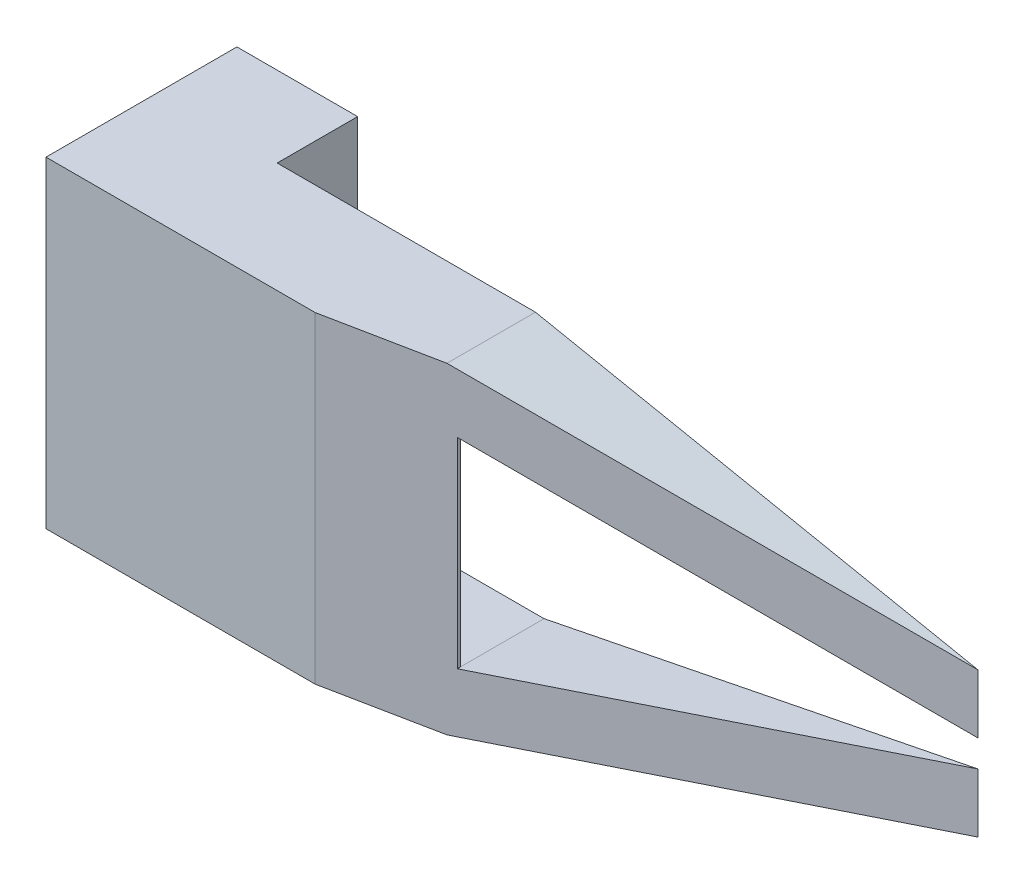
from build123d import *

# Parameters (mm, degrees)
BOSS_EXTRUDE1_DEPTH = 12
CUT_EXTRUDE1_DEPTH  = 8
CUT_EXTRUDE2_DEPTH  = 8
SKETCH6_W           = 4.5
SKETCH6_H           = 12
BOSS_EXTRUDE2_DEPTH = 3
BOSS_EXTRUDE3_DEPTH = 12
CUT_EXTRUDE3_START  = -14.451452
SKETCH8_W           = 3.67843884
SKETCH8_H           = 7.47183246
CUT_EXTRUDE3_DEPTH  = 14.451452


with BuildPart() as part:
    # Sketch1 → Boss-Extrude1 (new body)
    with BuildSketch(Plane(origin=(0, 0, 0), x_dir=(1, 0, 0), z_dir=(0, 1, 0))):
        Polygon((20.786387433, 2.157277486), (8.786387433, 2.157277486), (8.786387433, 5.883484052), (39.417420271, 5.883484052), align=None)
    extrude(amount=BOSS_EXTRUDE1_DEPTH)

    # Sketch4 → Cut-Extrude1 (cut)
    with BuildSketch(Plane(origin=(0, 0, -5.883484052), x_dir=(-1, 0, 0), z_dir=(0, 0, -1))):
        Polygon((-39.417420271, 3.299999999), (-22.917420271, 0), (-39.417420271, 0), align=None)
    cut_extrude1 = extrude(amount=-CUT_EXTRUDE1_DEPTH, mode=Mode.SUBTRACT)

    # Sketch5 → Cut-Extrude2 (cut)
    with BuildSketch(Plane(origin=(0, 0, -5.883484052), x_dir=(-1, 0, 0), z_dir=(0, 0, -1))):
        Polygon((-39.417420271, 6.5), (-23.237839122, 9.73591623), (-23.237839122, 2.26408377), (-39.417420271, 5.5), align=None)
    extrude(amount=-CUT_EXTRUDE2_DEPTH, mode=Mode.SUBTRACT)

    # Mirror1: Cut-Extrude1 across plane
    add(cut_extrude1.mirror(Plane.ZX.offset(6)), mode=Mode.SUBTRACT)

    # Sketch6 → Boss-Extrude2 (add)
    with BuildSketch(Plane(origin=(0, 0, -5.883484052), x_dir=(-1, 0, 0), z_dir=(0, 0, -1))):
        with Locations((-11.03638743, 6)):
            Rectangle(SKETCH6_W, SKETCH6_H)
    extrude(amount=BOSS_EXTRUDE2_DEPTH)

    # Sketch7 → Boss-Extrude3 (add)
    with BuildSketch(Plane(origin=(0, 12, 0), x_dir=(1, 0, 0), z_dir=(0, 1, 0))):
        Polygon((20.786387433, 2.157277486), (18.825226081, 1.765045216), (8.786387433, 1.765045216), (8.786387433, 2.157277486), align=None)
    extrude(amount=-BOSS_EXTRUDE3_DEPTH)

    # Sketch8 → Cut-Extrude3 (cut)
    with BuildSketch(Plane.ZY.offset(-8.786387433).offset(CUT_EXTRUDE3_START)):
        with Locations((-4.604264636, 6)):
            Rectangle(SKETCH8_W, SKETCH8_H)
    extrude(amount=CUT_EXTRUDE3_DEPTH, mode=Mode.SUBTRACT)


solid = part.part
